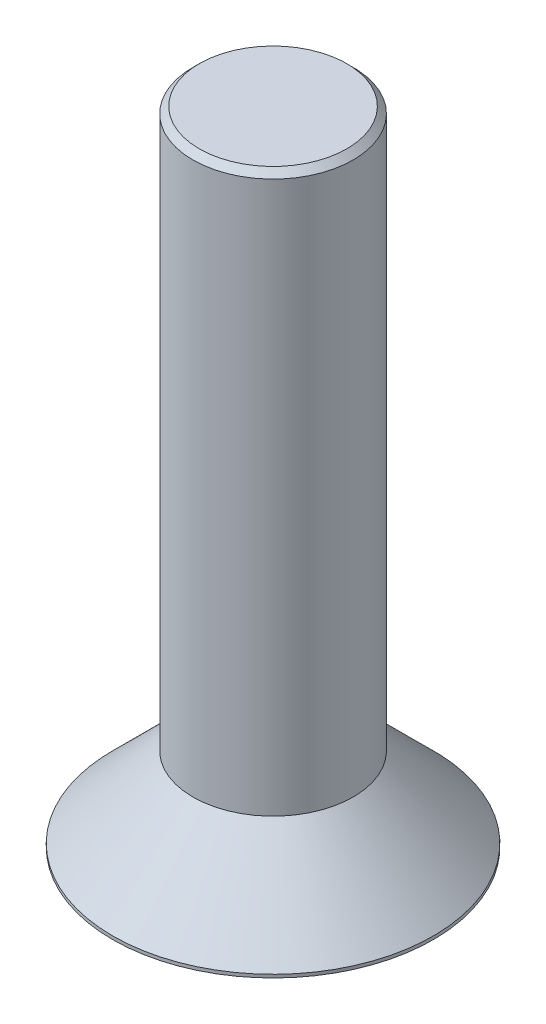
from build123d import *

# Parameters (mm, degrees)
SKETCH_1_R          = 5
EXTRUDE_1_DEPTH     = 2.6
CHAMFER_1_SIZE      = 2.5
CUT_EXTRUDE_1_DEPTH = 0.95
SKETCH_3_R          = 2.5
EXTRUDE_2_DEPTH     = 17.4
CHAMFER_2_SIZE      = 0.2


with BuildPart() as part:
    # 草图1 → 凸台-拉伸1 (new body)
    with BuildSketch(Plane(origin=(0, 0, 0), x_dir=(1, 0, 0), z_dir=(0, 1, 0))):
        with Locations(Location((0, 0, 0), (0, 0, 270))):
            Circle(SKETCH_1_R)
    extrude(amount=EXTRUDE_1_DEPTH)

    # 倒角1
    chamfer_1_edges = [part.edges().sort_by_distance(p)[0] for p in [
        (0, 2.6, -5),
    ]]
    chamfer(chamfer_1_edges, length=CHAMFER_1_SIZE)

    # 草图2 → 切除-拉伸1 (cut)
    with BuildSketch(Plane.XZ):
        Polygon((1.54, -0.889119415), (1.54, 0.889119415), (0, 1.778238829), (-1.54, 0.889119415), (-1.54, -0.889119415), (0, -1.778238829), align=None)
    extrude(amount=-CUT_EXTRUDE_1_DEPTH, mode=Mode.SUBTRACT)

    # 草图3 → 凸台-拉伸2 (add)
    with BuildSketch(Plane(origin=(0, 2.6, 0), x_dir=(1, 0, 0), z_dir=(0, 1, 0))):
        with Locations(Location((0, 0, 0), (0, 0, 270))):
            Circle(SKETCH_3_R)
    extrude(amount=EXTRUDE_2_DEPTH)

    # 倒角2
    chamfer_2_edges = [part.edges().sort_by_distance(p)[0] for p in [
        (0, 20, -2.5),
    ]]
    chamfer(chamfer_2_edges, length=CHAMFER_2_SIZE)


solid = part.part
